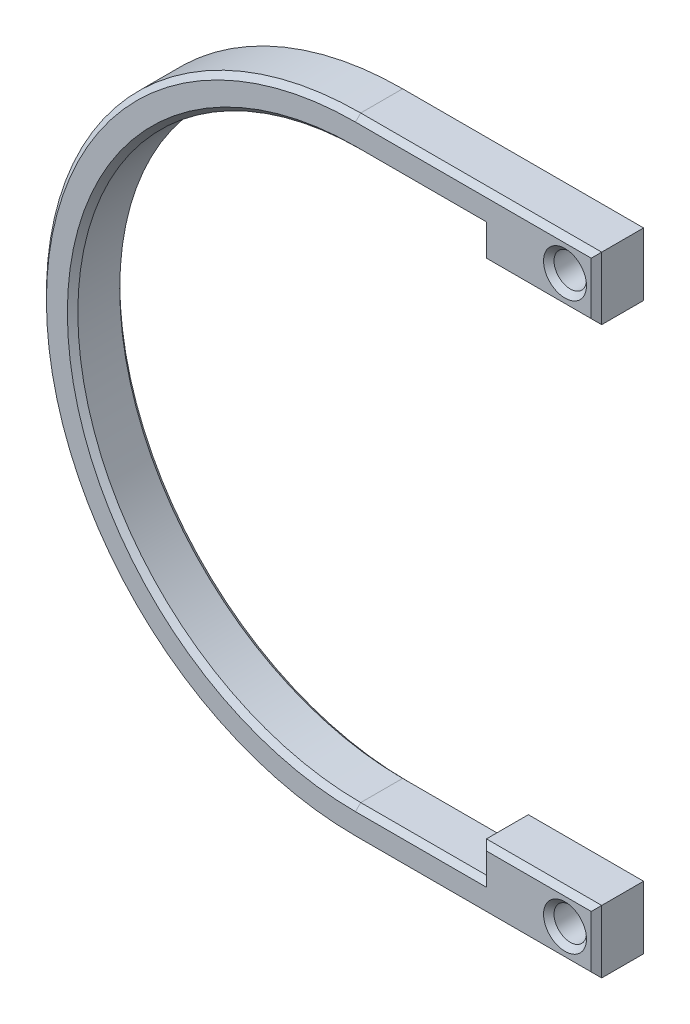
from build123d import *

# Parameters (mm, degrees)
EXTRUDE_1_DEPTH     = 5
SKETCH_3_W          = 5
SKETCH_3_H          = 6
EXTRUDE_2_DEPTH     = 5
SKETCH_2_R          = 1.55
CUT_EXTRUDE_1_DEPTH = 43.720018727
CHAMFER_1_SIZE      = 0.5


with BuildPart() as part:
    # ｽｹｯﾁ1 → ﾎﾞｽ - 押し出し1 (new body)
    with BuildSketch(Plane.XY):
        with BuildLine():
            Line((0, 30), (18, 30))
            Line((18, 30), (18, 24))
            Line((18, 24), (12, 24))
            Line((12, 24), (12, 27))
            Line((12, 27), (0, 27))
            ThreePointArc((0, 27), (-27, 0), (0, -27))
            Line((0, -27), (12, -27))
            Line((12, -27), (12, -24))
            Line((12, -24), (18, -24))
            Line((18, -24), (18, -30))
            Line((18, -30), (0, -30))
            ThreePointArc((0, -30), (-30, 0), (0, 30))
        make_face()
    extrude(amount=EXTRUDE_1_DEPTH)

    # ｽｹｯﾁ3 → ﾎﾞｽ - 押し出し2 (add)
    with BuildSketch(Plane.XY.offset(5)):
        with Locations((20.5, -27)):
            Rectangle(SKETCH_3_W, SKETCH_3_H)
        with Locations((20.5, 27)):
            Rectangle(SKETCH_3_W, SKETCH_3_H)
    extrude(amount=-EXTRUDE_2_DEPTH)

    # ｽｹｯﾁ2 → ｶｯﾄ - 押し出し1 (cut, through all)
    with BuildSketch(Plane.XY.offset(5)):
        with Locations((20, -27)):
            Circle(SKETCH_2_R)
        with Locations((20, 27)):
            Circle(SKETCH_2_R)
    extrude(amount=-CUT_EXTRUDE_1_DEPTH, mode=Mode.SUBTRACT)

    # 面取り1
    chamfer_1_edges = [part.edges().sort_by_distance(p)[0] for p in [
        (11.5, 30, 0),
        (17.5, 24, 0),
        (12, 25.5, 0),
        (6, 27, 0),
        (-27, 0, 0),
        (17.5, -24, 5),
        (6, -27, 0),
        (12, -25.5, 0),
        (17.5, -24, 0),
        (11.5, -30, 0),
        (-30, 0, 0),
        (12, -25.5, 5),
        (6, -27, 5),
        (-27, 0, 5),
        (6, 27, 5),
        (12, 25.5, 5),
        (17.5, 24, 5),
        (23, -27, 5),
        (23, -27, 0),
        (11.5, 30, 5),
        (-30, 0, 5),
        (23, 27, 5),
        (23, 27, 0),
        (18.45, -27, 0),
        (18.45, -27, 5),
        (18.45, 27, 0),
        (18.45, 27, 5),
        (11.5, -30, 5),
    ]]
    chamfer(chamfer_1_edges, length=CHAMFER_1_SIZE)


solid = part.part
